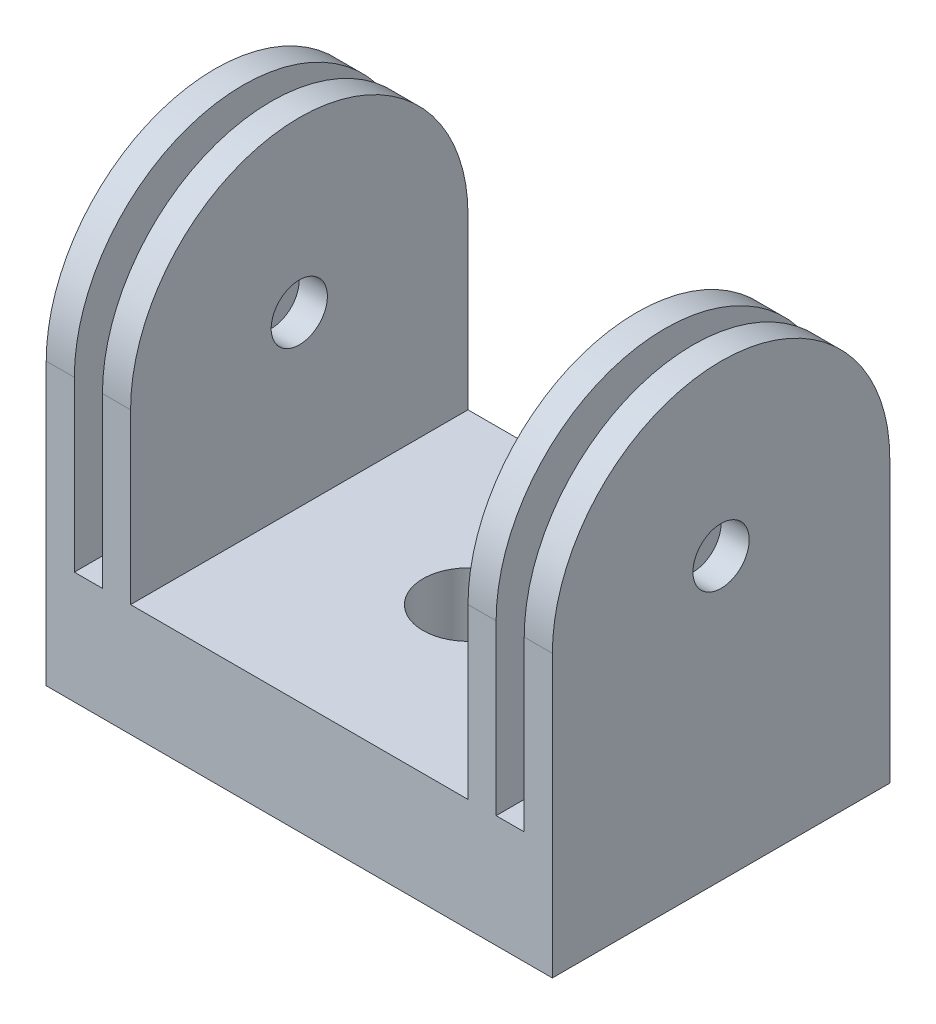
from build123d import *

# Parameters (mm, degrees)
SKETCH1_W               = 45
SKETCH1_H               = 30
SKETCH1_R               = 4
BOSS_EXTRUDE1_DEPTH     = 10
SKETCH2_R               = 2.5
BOSS_EXTRUDE2_DEPTH     = 2.5
MIRROR3_COPY_1_SKETCH_R = 2.5
MIRROR3_COPY_1_DEPTH    = 2.5


with BuildPart() as part:
    # Sketch1 → Boss-Extrude1 (new body)
    with BuildSketch(Plane(origin=(0, 0, 0), x_dir=(1, 0, 0), z_dir=(0, 1, 0))):
        Rectangle(SKETCH1_W, SKETCH1_H)
        with Locations(Location((0, 0, 0), (0, 0, 270))):
            Circle(SKETCH1_R, mode=Mode.SUBTRACT)
    extrude(amount=BOSS_EXTRUDE1_DEPTH)

    # Sketch2 → Boss-Extrude2 (add)
    with BuildSketch(Plane(origin=(22.5, 0, 0), x_dir=(0, 0, -1), z_dir=(1, 0, 0))):
        with BuildLine():
            Line((-15, 10), (15, 10))
            Line((15, 10), (15, 25))
            ThreePointArc((15, 25), (0, 40), (-15, 25))
            Line((-15, 25), (-15, 10))
        make_face()
        with Locations((0, 25)):
            Circle(SKETCH2_R, mode=Mode.SUBTRACT)
    boss_extrude2 = extrude(amount=-BOSS_EXTRUDE2_DEPTH)

    # Mirror2: Boss-Extrude2 across plane
    add(boss_extrude2.mirror(Plane(origin=(18.75, 0, 0), x_dir=(0, 0, 1), z_dir=(1, 0, 0))))

    # Mirror3: Boss-Extrude2 across plane
    add(boss_extrude2.mirror(Plane(origin=(0, 0, 0), x_dir=(0, 0, 1), z_dir=(1, 0, 0))))

    # Mirror3 copy 1 sketch → Mirror3 copy 1 (add)
    with BuildSketch(Plane(origin=(-15, 0, 0), x_dir=(0, 0, -1), z_dir=(1, 0, 0))):
        with BuildLine():
            Line((-15, 10), (15, 10))
            Line((15, 10), (15, 25))
            ThreePointArc((15, 25), (0, 40), (-15, 25))
            Line((-15, 25), (-15, 10))
        make_face()
        with Locations((0, 25)):
            Circle(MIRROR3_COPY_1_SKETCH_R, mode=Mode.SUBTRACT)
    extrude(amount=-MIRROR3_COPY_1_DEPTH)


solid = part.part
